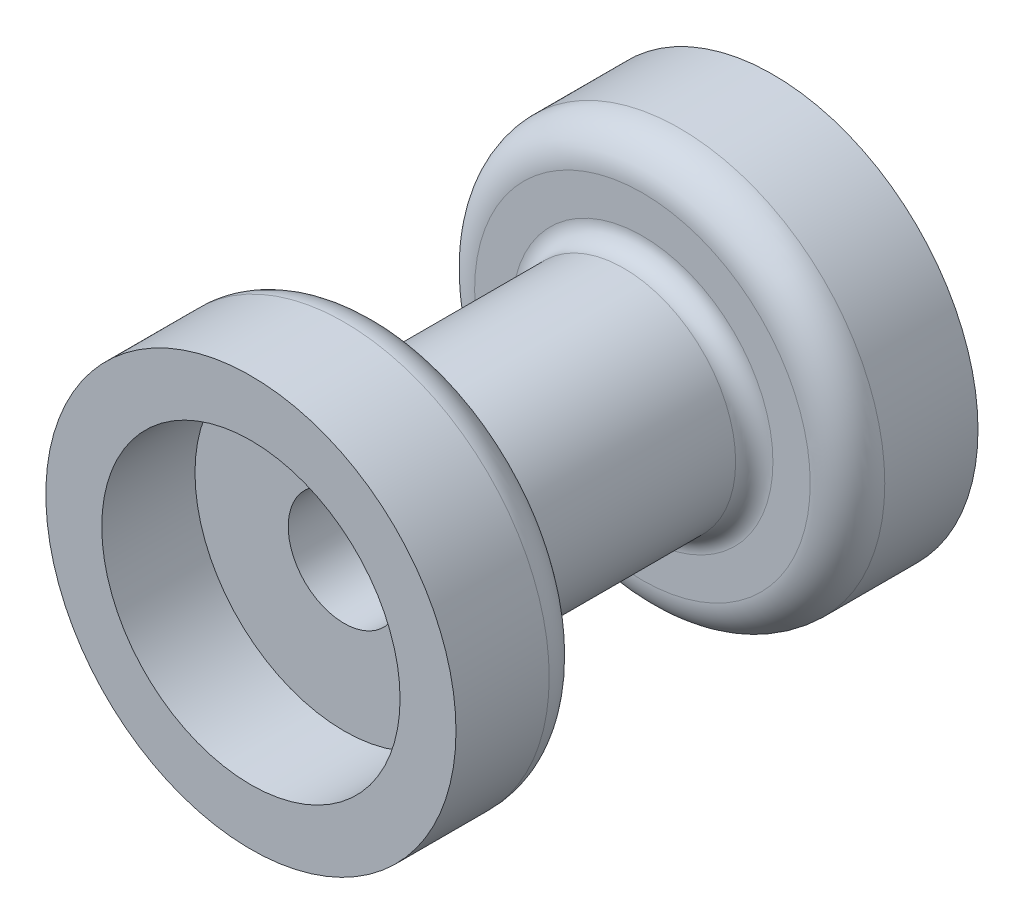
from build123d import *


with BuildPart() as part:
    # Esboço1 → Revolução1 (revolve)
    with BuildSketch(Plane(origin=(0, 0, 0), x_dir=(0, 0, -1), z_dir=(1, 0, 0)), mode=Mode.PRIVATE) as revolu_o1_sk:
        with BuildLine():
            Line((0, 8), (0, 11))
            Line((0, 11), (5, 11))
            ThreePointArc((5, 11), (6.414213562, 10.414213562), (7, 9))
            Line((7, 9), (7, 7))
            ThreePointArc((7, 7), (7.292893219, 6.292893219), (8, 6))
            Line((8, 6), (20, 6))
            ThreePointArc((20, 6), (20.707106781, 6.292893219), (21, 7))
            Line((21, 7), (21, 9))
            ThreePointArc((21, 9), (21.585786438, 10.414213562), (23, 11))
            Line((23, 11), (28, 11))
            Line((28, 11), (28, 8))
            Line((28, 8), (23, 8))
            Line((23, 8), (23, 3))
            Line((23, 3), (5, 3))
            Line((5, 3), (5, 8))
            Line((5, 8), (0, 8))
        make_face()
    revolve(revolu_o1_sk.sketch.rotate(Axis((0, 0, 0), (0, 0, -1)), 90), axis=Axis((0, 0, 0), (0, 0, -1)))


solid = part.part
